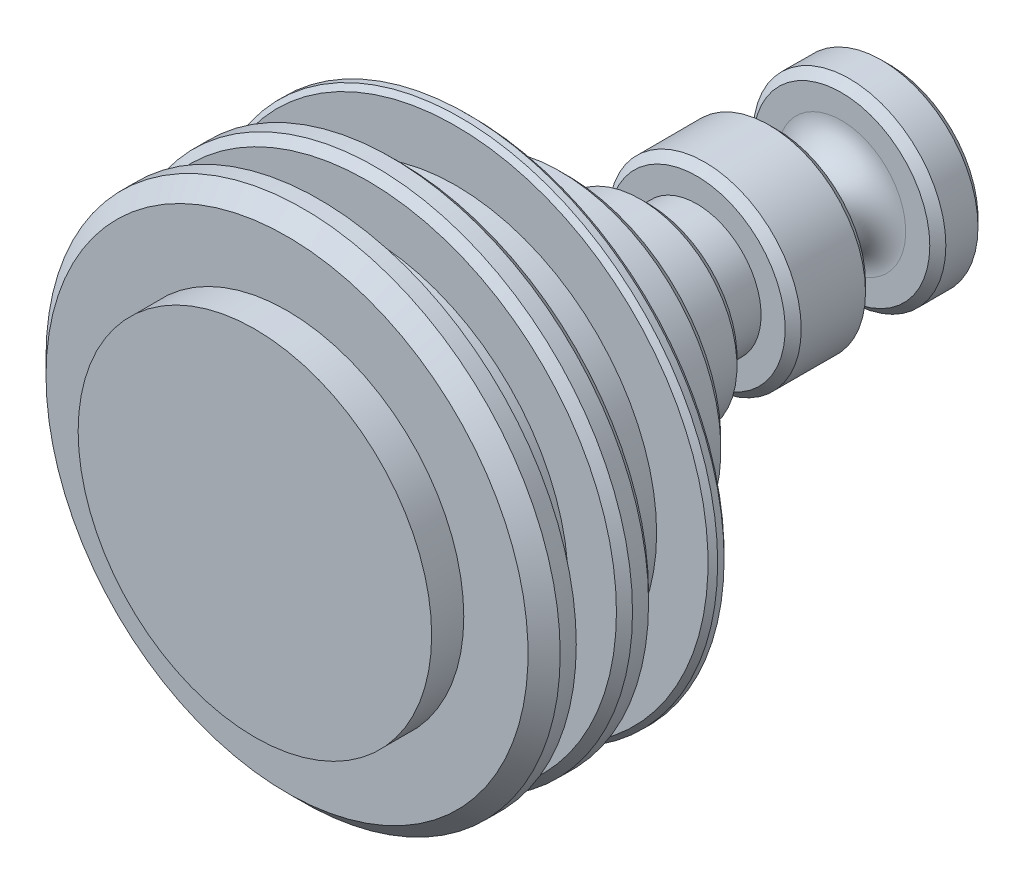
from build123d import *

# Parameters (mm, degrees)
ESQUISSE1_R      = 11
FOND_DEPTH       = 2
ESQUISSE2_R      = 16
CYLINDRE_1_DEPTH = 2
ESQUISSE3_R      = 12.5
CYLINDRE_2_DEPTH = 3
ESQUISSE4_R      = 16
CYLINDRE_3_DEPTH = 2
ESQUISSE5_R      = 12.5
CYLINDRE_4_DEPTH = 3.5
ESQUISSE6_R      = 16
CYLINDRE_5_DEPTH = 1
ESQUISSE7_R      = 10
CYLINDRE_6_DEPTH = 6
ESQUISSE8_R      = 6
CYLINDRE_7_DEPTH = 5
ESQUISSE9_R      = 4
CYLINDRE_8_DEPTH = 3
ESQUISSE12_R     = 6
CYLINDRE_9_DEPTH = 12
CHANFREIN1_SIZE  = 0.5
CHANFREIN2_SIZE  = 0.3
CHANFREIN3_SIZE  = 1


with BuildPart() as part:
    # Esquisse1 → fond (new body)
    with BuildSketch(Plane.XY):
        with Locations(Location((0, 0, 0), (0, 0, 180))):
            Circle(ESQUISSE1_R)
    extrude(amount=FOND_DEPTH)

    # Esquisse2 → cylindre 1 (add)
    with BuildSketch(Plane(origin=(0, 0, 0), x_dir=(-1, 0, 0), z_dir=(0, 0, -1))):
        Circle(ESQUISSE2_R)
    extrude(amount=CYLINDRE_1_DEPTH)

    # Esquisse3 → cylindre 2 (add)
    with BuildSketch(Plane(origin=(0, 0, -2), x_dir=(-1, 0, 0), z_dir=(0, 0, -1))):
        Circle(ESQUISSE3_R)
    extrude(amount=CYLINDRE_2_DEPTH)

    # Esquisse4 → cylindre 3 (add)
    with BuildSketch(Plane(origin=(0, 0, -5), x_dir=(-1, 0, 0), z_dir=(0, 0, -1))):
        Circle(ESQUISSE4_R)
    extrude(amount=CYLINDRE_3_DEPTH)

    # Esquisse5 → cylindre 4 (add)
    with BuildSketch(Plane(origin=(0, 0, -7), x_dir=(-1, 0, 0), z_dir=(0, 0, -1))):
        Circle(ESQUISSE5_R)
    extrude(amount=CYLINDRE_4_DEPTH)

    # Esquisse6 → cylindre 5 (add)
    with BuildSketch(Plane(origin=(0, 0, -10.5), x_dir=(-1, 0, 0), z_dir=(0, 0, -1))):
        Circle(ESQUISSE6_R)
    extrude(amount=CYLINDRE_5_DEPTH)

    # Esquisse7 → cylindre 6 (add)
    with BuildSketch(Plane(origin=(0, 0, -11.5), x_dir=(-1, 0, 0), z_dir=(0, 0, -1))):
        Circle(ESQUISSE7_R)
    extrude(amount=CYLINDRE_6_DEPTH)

    # Esquisse8 → cylindre 7 (add)
    with BuildSketch(Plane(origin=(0, 0, -17.5), x_dir=(-1, 0, 0), z_dir=(0, 0, -1))):
        with Locations(Location((0, 0, 0), (0, 0, 180))):
            Circle(ESQUISSE8_R)
    extrude(amount=CYLINDRE_7_DEPTH)

    # Esquisse9 → cylindre 8 (add)
    with BuildSketch(Plane(origin=(0, 0, -22.5), x_dir=(-1, 0, 0), z_dir=(0, 0, -1))):
        Circle(ESQUISSE9_R)
    extrude(amount=CYLINDRE_8_DEPTH)

    # Esquisse12 → cylindre 9 (add)
    with BuildSketch(Plane(origin=(0, 0, -25.5), x_dir=(-1, 0, 0), z_dir=(0, 0, -1))):
        with Locations(Location((0, 0, 0), (0, 0, 180))):
            Circle(ESQUISSE12_R)
    extrude(amount=CYLINDRE_9_DEPTH)

    # gorge: sweep along a path in Esquisse16
    with BuildLine(Plane.XY.offset(-32.5)) as gorge_path:
        CenterArc((0, 0), 2, 0, 360)
    # Esquisse13 → gorge (sweep, cut)
    with BuildSketch(Plane(origin=(0, 0, 0), x_dir=(1, 0, 0), z_dir=(0, 1, 0))):
        with BuildLine():
            Line((-10.48576902, 34.5), (-4, 34.5))
            ThreePointArc((-4, 34.5), (-2, 32.5), (-4, 30.5))
            Line((-4, 30.5), (-10.48576902, 30.5))
            Line((-10.48576902, 30.5), (-10.48576902, 34.5))
        make_face()
    sweep(path=gorge_path.line, mode=Mode.SUBTRACT)

    # Chanfrein1
    chanfrein1_edges = [part.edges().sort_by_distance(p)[0] for p in [
        (-6, 0, -25.5),
        (-5.999999999, -2e-09, -30.5),
        (-6, 0, -22.5),
        (-5.999999999, -2e-09, -34.5),
        (-6, 0, -37.5),
        (10, 0, -17.5),
        (12.5, 0, -7),
        (16, 0, -7),
        (16, 0, -5),
    ]]
    chamfer(chanfrein1_edges, length=CHANFREIN1_SIZE)

    # Chanfrein2
    chanfrein2_edges = [part.edges().sort_by_distance(p)[0] for p in [
        (16, 0, -11.5),
        (16, 0, -10.5),
    ]]
    chamfer(chanfrein2_edges, length=CHANFREIN2_SIZE)

    # Chanfrein3
    chanfrein3_edges = [part.edges().sort_by_distance(p)[0] for p in [
        (16, 0, 0),
    ]]
    chamfer(chanfrein3_edges, length=CHANFREIN3_SIZE)


solid = part.part
